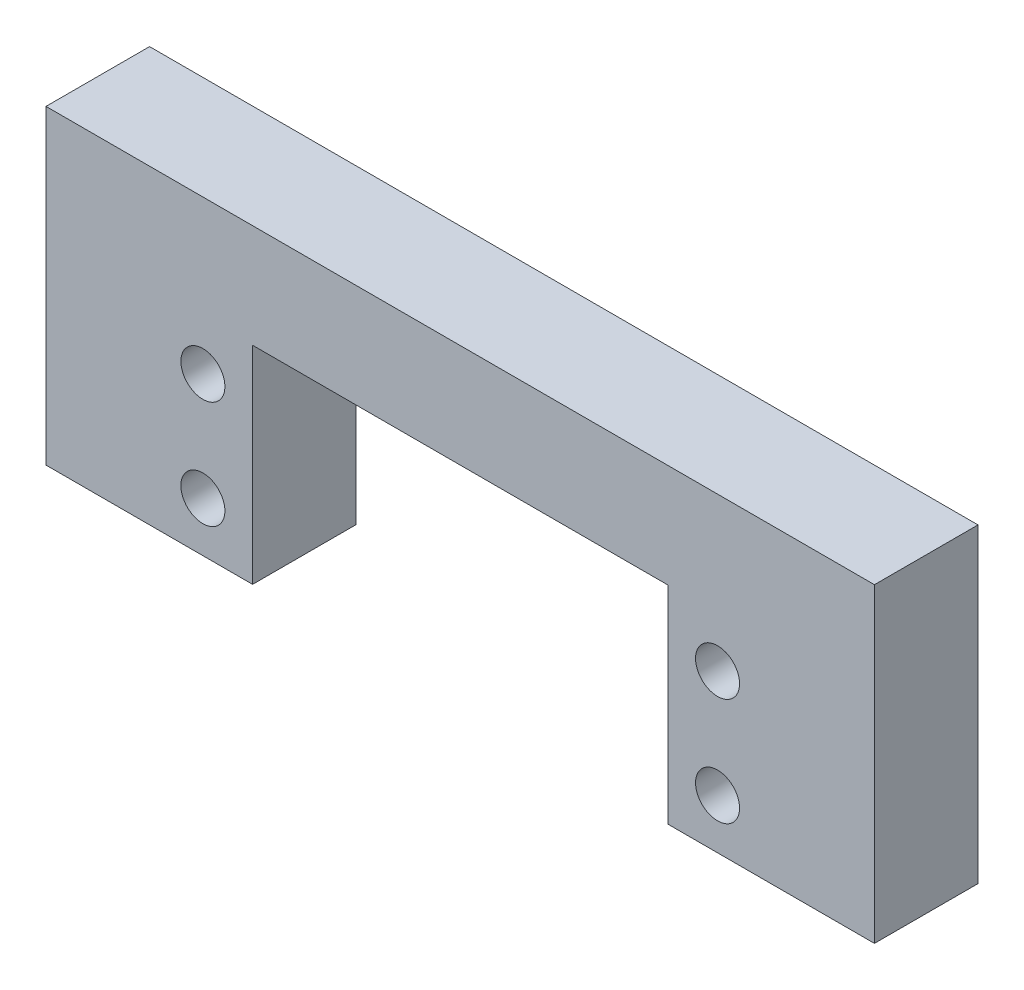
from build123d import *

# Parameters (mm, degrees)
BOSS_EXTRUDE1_DEPTH = 10
SKETCH2_R           = 2
CUT_EXTRUDE1_DEPTH  = 15
SKETCH3_R           = 2.125
CUT_EXTRUDE2_DEPTH  = 87.02325267


with BuildPart() as part:
    # Sketch1 → Boss-Extrude1 (new body)
    with BuildSketch(Plane.XY):
        Polygon((0, 0), (19.95, 0), (19.95, 20), (60.05, 20), (60.05, 0), (80, 0), (80, 30), (0, 30), align=None)
    extrude(amount=BOSS_EXTRUDE1_DEPTH)

    # Sketch2 → Cut-Extrude1 (cut)
    with BuildSketch(Plane.XZ):
        with Locations(Location((5, 5, 0), (0, 0, 270))):
            Circle(SKETCH2_R)
        with Locations(Location((75, 5, 0), (0, 0, 270))):
            Circle(SKETCH2_R)
    extrude(amount=-CUT_EXTRUDE1_DEPTH, mode=Mode.SUBTRACT)

    # Sketch3 → Cut-Extrude2 (cut, through all)
    with BuildSketch(Plane.XY.offset(10)):
        with Locations((15.15, 4.8)):
            Circle(SKETCH3_R)
        with Locations((15.15, 15.2)):
            Circle(SKETCH3_R)
        with Locations(Location((64.85, 15.2, 0), (0, 0, 180))):
            Circle(SKETCH3_R)
        with Locations(Location((64.85, 4.8, 0), (0, 0, 180))):
            Circle(SKETCH3_R)
    extrude(amount=-CUT_EXTRUDE2_DEPTH, mode=Mode.SUBTRACT)


solid = part.part
